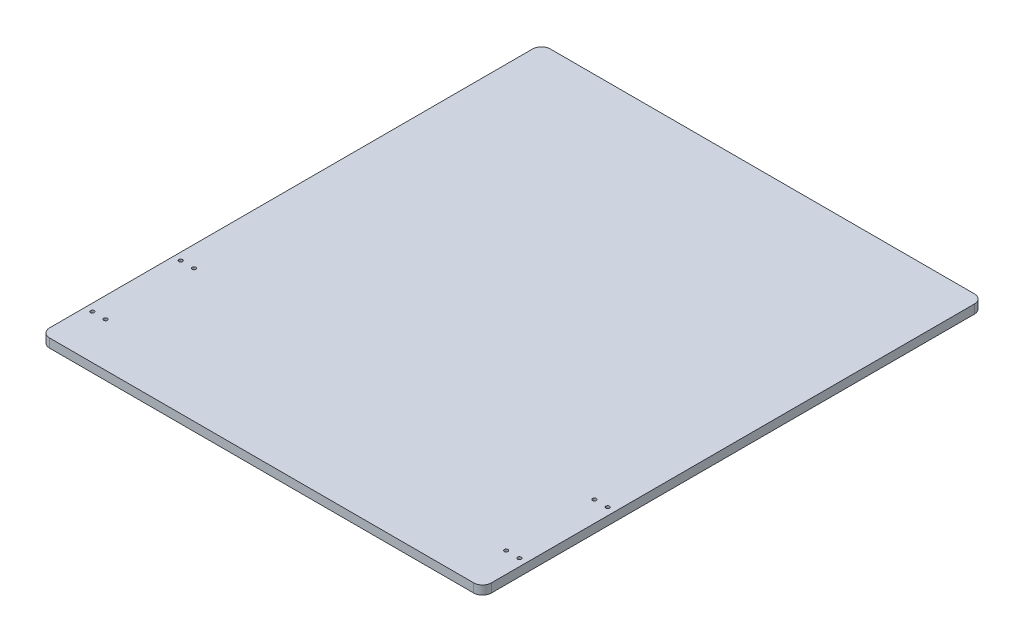
from build123d import *

# Parameters (mm, degrees)
SKETCH1_W           = 300
SKETCH1_H           = 340
BOSS_EXTRUDE1_DEPTH = 6
FILLET1_R           = 6
SKETCH2_R           = 1.25
CUT_EXTRUDE1_DEPTH  = 227.795061675


with BuildPart() as part:
    # Sketch1 → Boss-Extrude1 (new body)
    with BuildSketch(Plane(origin=(0, 0, 0), x_dir=(1, 0, 0), z_dir=(0, 1, 0))):
        Rectangle(SKETCH1_W, SKETCH1_H)
    extrude(amount=BOSS_EXTRUDE1_DEPTH)

    # Fillet1
    fillet1_edges = [part.edges().sort_by_distance(p)[0] for p in [
        (150, 3, 170),
        (-150, 3, 170),
        (-150, 3, -170),
        (150, 3, -170),
    ]]
    fillet(fillet1_edges, radius=FILLET1_R)

    # Sketch2 → Cut-Extrude1 (cut, through all)
    with BuildSketch(Plane(origin=(0, 6, 0), x_dir=(1, 0, 0), z_dir=(0, 1, 0))):
        with Locations(Location((136, -80, 0), (0, 0, 270))):
            Circle(SKETCH2_R)
        with Locations(Location((145, -80, 0), (0, 0, 270))):
            Circle(SKETCH2_R)
        with Locations(Location((145, -140, 0), (0, 0, 270))):
            Circle(SKETCH2_R)
        with Locations(Location((136, -140, 0), (0, 0, 270))):
            Circle(SKETCH2_R)
        with Locations(Location((-136, -140, 0), (0, 0, 90))):
            Circle(SKETCH2_R)
        with Locations(Location((-145, -140, 0), (0, 0, 90))):
            Circle(SKETCH2_R)
        with Locations(Location((-145, -80, 0), (0, 0, 90))):
            Circle(SKETCH2_R)
        with Locations(Location((-136, -80, 0), (0, 0, 90))):
            Circle(SKETCH2_R)
    extrude(amount=-CUT_EXTRUDE1_DEPTH, mode=Mode.SUBTRACT)


solid = part.part
